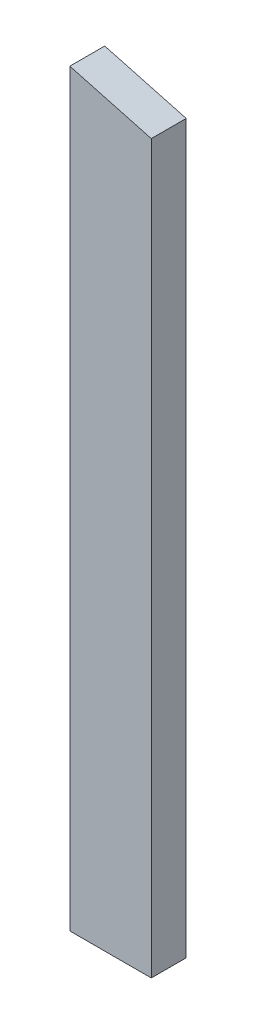
from build123d import *

# Parameters (mm, degrees)
BOSS_EXTRUDE1_DEPTH = 38.1


with BuildPart() as part:
    # Sketch1 → Boss-Extrude1 (new body)
    with BuildSketch(Plane.XY):
        Polygon((-339.671290992, 34.196787186), (-250.771290992, 34.196787186), (-250.771290992, 827.236897), (-339.671290992, 851.209930708), align=None)
    extrude(amount=BOSS_EXTRUDE1_DEPTH)


solid = part.part
